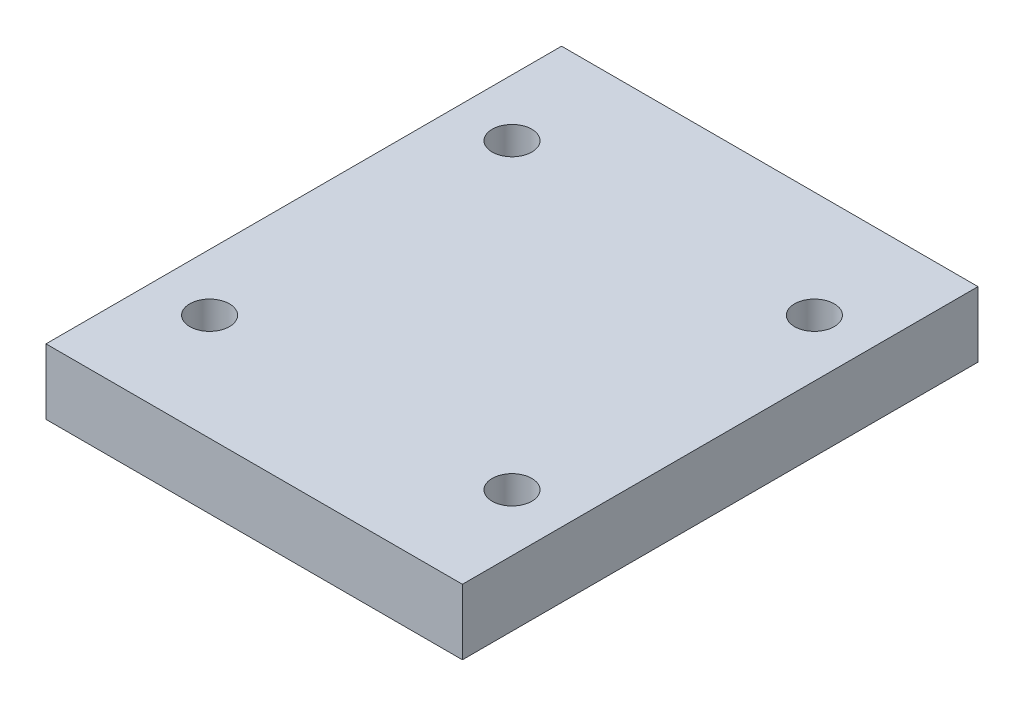
from build123d import *

# Parameters (mm, degrees)
SKETCH1_W           = 42
SKETCH1_H           = 52
BOSS_EXTRUDE1_DEPTH = 6.6
SKETCH2_R           = 2
CUT_EXTRUDE2_DEPTH  = 6.6


with BuildPart() as part:
    # Sketch1 → Boss-Extrude1 (new body)
    with BuildSketch(Plane(origin=(0, 0, 0), x_dir=(1, 0, 0), z_dir=(0, 1, 0))):
        Rectangle(SKETCH1_W, SKETCH1_H)
    extrude(amount=BOSS_EXTRUDE1_DEPTH)

    # Sketch2 → Cut-Extrude2 (cut)
    with BuildSketch(Plane(origin=(0, 6.6, 0), x_dir=(1, 0, 0), z_dir=(0, 1, 0))):
        with Locations(Location((-15.25, 15.25, 0), (0, 0, 270))):
            Circle(SKETCH2_R)
        with Locations(Location((15.25, 15.25, 0), (0, 0, 270))):
            Circle(SKETCH2_R)
        with Locations(Location((15.25, -15.25, 0), (0, 0, 270))):
            Circle(SKETCH2_R)
        with Locations(Location((-15.25, -15.25, 0), (0, 0, 270))):
            Circle(SKETCH2_R)
    extrude(amount=-CUT_EXTRUDE2_DEPTH, mode=Mode.SUBTRACT)


solid = part.part
